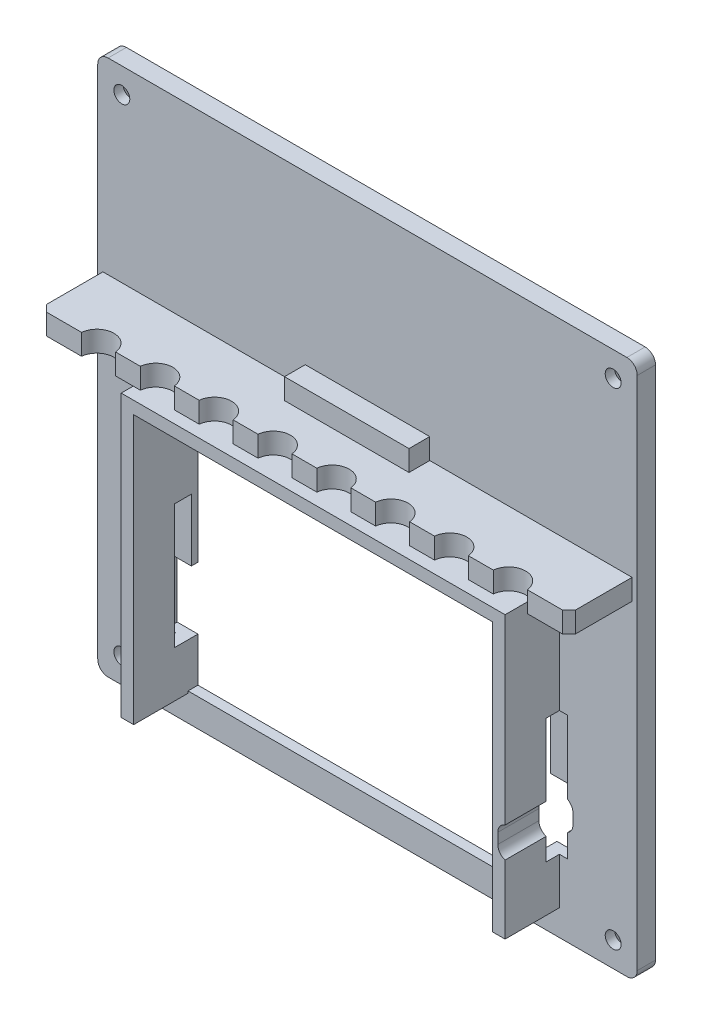
from build123d import *

# Parameters (mm, degrees)
SKETCH1_W                                      = 83.058
SKETCH1_H                                      = 82.55
BOSS_EXTRUDE1_DEPTH                            = 2.794
SKETCH2_W                                      = 58.7375
SKETCH2_H                                      = 42.9895
SKETCH2_W_2                                    = 54.9275
SKETCH2_H_2                                    = 39.1795
BOSS_EXTRUDE2_DEPTH                            = 11.1125
SKETCH5_W                                      = 66.929
SKETCH5_H                                      = 49.403
CUT_EXTRUDE1_DEPTH                             = 1.27
SKETCH2_2_W                                    = 54.9275
SKETCH2_2_H                                    = 39.1795
CUT_EXTRUDE2_DEPTH                             = 60.596737513
CSK_FOR_2_FLAT_HEAD_MACHINE_SCREW1_D           = 2.4384
CSK_FOR_2_FLAT_HEAD_MACHINE_SCREW1_CSINK_D     = 4.8104044
CSK_FOR_2_FLAT_HEAD_MACHINE_SCREW1_CSINK_ANGLE = 82
SKETCH9_W                                      = 12.7
SKETCH9_H                                      = 2.54
CUT_EXTRUDE4_DEPTH                             = 9.8044
SKETCH10_W                                     = 12.7
SKETCH10_H                                     = 3.048
CUT_EXTRUDE5_DEPTH                             = 0.254
SKETCH11_W                                     = 3.175
SKETCH11_H                                     = 9.525
CUT_EXTRUDE7_DEPTH                             = 1.524
SKETCH12_W                                     = 2.032
SKETCH12_H                                     = 19.05
CUT_EXTRUDE8_DEPTH                             = 82.161030266
SKETCH14_W                                     = 3.175
SKETCH14_H                                     = 19.05
CUT_EXTRUDE11_DEPTH                            = 0.508
FILLET2_R                                      = 4.7625
SKETCH15_W                                     = 54.9275
SKETCH15_H                                     = 1.905
CUT_EXTRUDE12_DEPTH                            = 8.3185
SKETCH16_W                                     = 54.9275
SKETCH16_H                                     = 1.524
CUT_EXTRUDE13_DEPTH                            = 1.5875
SKETCH17_W                                     = 12.7
SKETCH17_H                                     = 2.6543
BOSS_EXTRUDE3_DEPTH                            = 0.1016
SKETCH18_W                                     = 12.7
SKETCH18_H                                     = 0.3556
CUT_EXTRUDE14_DEPTH                            = 0.1016
SKETCH19_W                                     = 161.493776118
SKETCH19_H                                     = 133.946930056
SKETCH19_W_2                                   = 82.55
SKETCH19_H_2                                   = 82.042
CUT_EXTRUDE15_DEPTH                            = 60.596737513
FILLET3_R                                      = 1.5875
SKETCH21_W                                     = 80.9625
SKETCH21_H                                     = 3.175
BOSS_EXTRUDE4_DEPTH                            = 9.906
SKETCH22_W                                     = 19.05
SKETCH22_H                                     = 9.525
BOSS_EXTRUDE5_DEPTH                            = 3.175
SKETCH23_W                                     = 12.7
SKETCH23_H                                     = 1.016
CUT_EXTRUDE16_DEPTH                            = 7.8994
SKETCH24_R                                     = 2.60985
CUT_EXTRUDE17_DEPTH                            = 67.163598214
SKETCH25_W                                     = 80.9625
SKETCH25_H                                     = 3.175
CUT_EXTRUDE18_DEPTH                            = 0.254
CHAMFER1_SIZE                                  = 1.016
CUT_EXTRUDE19_DEPTH                            = 60.255810196
SKETCH29_W                                     = 54.9275
SKETCH29_H                                     = 4.1021
CUT_EXTRUDE20_DEPTH                            = 0.381
CHAMFER2_SIZE                                  = 0.508


with BuildPart() as part:
    # Sketch1 → Boss-Extrude1 (new body)
    with BuildSketch(Plane.XY):
        Rectangle(SKETCH1_W, SKETCH1_H)
    extrude(amount=BOSS_EXTRUDE1_DEPTH)

    # Sketch2 → Boss-Extrude2 (add)
    with BuildSketch(Plane(origin=(0, 0, 0), x_dir=(-1, 0, 0), z_dir=(0, 0, -1))):
        with Locations((0, -15.56385)):
            Rectangle(SKETCH2_W, SKETCH2_H)
        with Locations((0, -15.56385)):
            Rectangle(SKETCH2_W_2, SKETCH2_H_2, mode=Mode.SUBTRACT)
    extrude(amount=-BOSS_EXTRUDE2_DEPTH)

    # Sketch5 → Cut-Extrude1 (cut)
    with BuildSketch(Plane(origin=(0, 0, 0), x_dir=(-1, 0, 0), z_dir=(0, 0, -1))):
        with Locations((0, -16.5735)):
            Rectangle(SKETCH5_W, SKETCH5_H)
    extrude(amount=-CUT_EXTRUDE1_DEPTH, mode=Mode.SUBTRACT)

    # Sketch2<2> → Cut-Extrude2 (cut, through all)
    with BuildSketch(Plane(origin=(0, 0, 0), x_dir=(-1, 0, 0), z_dir=(0, 0, -1))):
        with Locations((0, -15.56385)):
            Rectangle(SKETCH2_2_W, SKETCH2_2_H)
    extrude(amount=-CUT_EXTRUDE2_DEPTH, mode=Mode.SUBTRACT)

    # CSK for #2 Flat Head Machine Screw1 (through all)
    with Locations(Plane(origin=(0, 0, 0), x_dir=(-1, 0, 0), z_dir=(0, 0, -1))):
        with Locations((37.592, 37.211), (-37.592, 37.211), (-37.592, -37.211), (37.592, -37.211)):
            CounterSinkHole(CSK_FOR_2_FLAT_HEAD_MACHINE_SCREW1_D / 2, CSK_FOR_2_FLAT_HEAD_MACHINE_SCREW1_CSINK_D / 2, counter_sink_angle=CSK_FOR_2_FLAT_HEAD_MACHINE_SCREW1_CSINK_ANGLE)

    # Sketch9 → Cut-Extrude4 (cut)
    with BuildSketch(Plane.XZ.offset(-4.0259)):
        with Locations((0, 2.54)):
            Rectangle(SKETCH9_W, SKETCH9_H)
    extrude(amount=-CUT_EXTRUDE4_DEPTH, mode=Mode.SUBTRACT)

    # Sketch10 → Cut-Extrude5 (cut)
    with BuildSketch(Plane.XY.offset(1.27)):
        with Locations((0, 12.3063)):
            Rectangle(SKETCH10_W, SKETCH10_H)
    extrude(amount=-CUT_EXTRUDE5_DEPTH, mode=Mode.SUBTRACT)

    # Sketch11 → Cut-Extrude7 (cut)
    with BuildSketch(Plane(origin=(0, 0, 1.27), x_dir=(-1, 0, 0), z_dir=(0, 0, -1))):
        with Locations((-29.05125, -25.2095)):
            Rectangle(SKETCH11_W, SKETCH11_H)
    cut_extrude7 = extrude(amount=-CUT_EXTRUDE7_DEPTH, mode=Mode.SUBTRACT)

    # Sketch12 → Cut-Extrude8 (cut, through all)
    with BuildSketch(Plane.ZY.offset(-27.46375)):
        with Locations((3.81, -20.447)):
            Rectangle(SKETCH12_W, SKETCH12_H)
    cut_extrude8 = extrude(amount=-CUT_EXTRUDE8_DEPTH, mode=Mode.SUBTRACT)

    # Sketch14 → Cut-Extrude11 (cut)
    with BuildSketch(Plane.XY.offset(2.794)):
        with Locations((29.05125, -20.447)):
            Rectangle(SKETCH14_W, SKETCH14_H)
    cut_extrude11 = extrude(amount=-CUT_EXTRUDE11_DEPTH, mode=Mode.SUBTRACT)

    # Mirror1: Cut-Extrude7, Cut-Extrude8, Cut-Extrude11 across plane
    add(cut_extrude7.mirror(Plane(origin=(0, 0, 0), x_dir=(0, 0, 1), z_dir=(1, 0, 0))), mode=Mode.SUBTRACT)
    add(cut_extrude8.mirror(Plane(origin=(0, 0, 0), x_dir=(0, 0, 1), z_dir=(1, 0, 0))), mode=Mode.SUBTRACT)
    add(cut_extrude11.mirror(Plane(origin=(0, 0, 0), x_dir=(0, 0, 1), z_dir=(1, 0, 0))), mode=Mode.SUBTRACT)

    # Fillet2
    fillet2_edges = [part.edges().sort_by_distance(p)[0] for p in [
        (-33.4645, 8.128, 0.635),
        (33.4645, 8.128, 0.635),
    ]]
    fillet(fillet2_edges, radius=FILLET2_R)

    # Sketch15 → Cut-Extrude12 (cut)
    with BuildSketch(Plane.XY.offset(11.1125)):
        with Locations((0, -36.1061)):
            Rectangle(SKETCH15_W, SKETCH15_H)
    extrude(amount=-CUT_EXTRUDE12_DEPTH, mode=Mode.SUBTRACT)

    # Sketch16 → Cut-Extrude13 (cut)
    with BuildSketch(Plane(origin=(0, -35.1536, 0), x_dir=(1, 0, 0), z_dir=(0, 1, 0))):
        with Locations((0, -2.032)):
            Rectangle(SKETCH16_W, SKETCH16_H)
    extrude(amount=-CUT_EXTRUDE13_DEPTH, mode=Mode.SUBTRACT)

    # Sketch17 → Boss-Extrude3 (add)
    with BuildSketch(Plane.XY.offset(1.27)):
        with Locations((0, 9.45515)):
            Rectangle(SKETCH17_W, SKETCH17_H)
    extrude(amount=BOSS_EXTRUDE3_DEPTH)

    # Sketch18 → Cut-Extrude14 (cut)
    with BuildSketch(Plane(origin=(0, 10.7823, 0), x_dir=(1, 0, 0), z_dir=(0, 1, 0))):
        with Locations((0, -1.1938)):
            Rectangle(SKETCH18_W, SKETCH18_H)
    extrude(amount=-CUT_EXTRUDE14_DEPTH, mode=Mode.SUBTRACT)

    # Sketch19 → Cut-Extrude15 (cut, through all)
    with BuildSketch(Plane(origin=(0, 0, 0), x_dir=(-1, 0, 0), z_dir=(0, 0, -1))):
        Rectangle(SKETCH19_W, SKETCH19_H)
        Rectangle(SKETCH19_W_2, SKETCH19_H_2, mode=Mode.SUBTRACT)
    extrude(amount=-CUT_EXTRUDE15_DEPTH, mode=Mode.SUBTRACT)

    # Fillet3
    fillet3_edges = [part.edges().sort_by_distance(p)[0] for p in [
        (41.275, 41.021, 1.397),
        (-41.275, 41.021, 1.397),
        (-41.275, -41.021, 1.397),
        (41.275, -41.021, 1.397),
    ]]
    fillet(fillet3_edges, radius=FILLET3_R)

    # Sketch21 → Boss-Extrude4 (add)
    with BuildSketch(Plane.XY.offset(2.794)):
        with Locations((0, 10.6934)):
            Rectangle(SKETCH21_W, SKETCH21_H)
    extrude(amount=BOSS_EXTRUDE4_DEPTH)

    # Sketch22 → Boss-Extrude5 (add)
    with BuildSketch(Plane.XY.offset(2.794)):
        with Locations((0, 10.6934)):
            Rectangle(SKETCH22_W, SKETCH22_H)
    extrude(amount=BOSS_EXTRUDE5_DEPTH)

    # Sketch23 → Cut-Extrude16 (cut)
    with BuildSketch(Plane.XZ.offset(-5.9309)):
        with Locations((0, 3.302)):
            Rectangle(SKETCH23_W, SKETCH23_H)
    extrude(amount=-CUT_EXTRUDE16_DEPTH, mode=Mode.SUBTRACT)

    # Sketch24 → Cut-Extrude17 (cut, through all)
    with BuildSketch(Plane.XZ.offset(-9.1059)):
        with Locations((-31.5, 12.7)):
            Circle(SKETCH24_R)
        with Locations((-22.5, 12.7)):
            Circle(SKETCH24_R)
        with Locations((31.5, 12.7)):
            Circle(SKETCH24_R)
        with Locations((22.5, 12.7)):
            Circle(SKETCH24_R)
        with Locations((13.5, 12.7)):
            Circle(SKETCH24_R)
        with Locations((4.5, 12.7)):
            Circle(SKETCH24_R)
        with Locations((-4.5, 12.7)):
            Circle(SKETCH24_R)
        with Locations((-13.5, 12.7)):
            Circle(SKETCH24_R)
    extrude(amount=-CUT_EXTRUDE17_DEPTH, mode=Mode.SUBTRACT)

    # Sketch25 → Cut-Extrude18 (cut)
    with BuildSketch(Plane.XY.offset(12.7)):
        with Locations((0, 10.6934)):
            Rectangle(SKETCH25_W, SKETCH25_H)
    extrude(amount=-CUT_EXTRUDE18_DEPTH, mode=Mode.SUBTRACT)

    # Chamfer1
    chamfer1_edges = [part.edges().sort_by_distance(p)[0] for p in [
        (-40.48125, 10.6934, 12.446),
        (40.48125, 10.6934, 12.446),
    ]]
    chamfer(chamfer1_edges, length=CHAMFER1_SIZE)

    # Sketch26 → Cut-Extrude19 (cut, through all)
    with BuildSketch(Plane(origin=(0, 0, 1.27), x_dir=(-1, 0, 0), z_dir=(0, 0, -1))):
        with BuildLine():
            Line((-28.2575, -23.45055), (-28.2575, -25.06345))
            ThreePointArc((-28.2575, -25.06345), (-29.845, -26.65095), (-31.4325, -25.06345))
            Line((-31.4325, -25.06345), (-31.4325, -23.45055))
            ThreePointArc((-31.4325, -23.45055), (-29.845, -21.86305), (-28.2575, -23.45055))
        make_face()
    extrude(amount=-CUT_EXTRUDE19_DEPTH, mode=Mode.SUBTRACT)

    # Sketch29 → Cut-Extrude20 (cut)
    with BuildSketch(Plane(origin=(0, 0, 1.27), x_dir=(-1, 0, 0), z_dir=(0, 0, -1))):
        with Locations((0, 6.07695)):
            Rectangle(SKETCH29_W, SKETCH29_H)
    extrude(amount=-CUT_EXTRUDE20_DEPTH, mode=Mode.SUBTRACT)

    # Chamfer2
    chamfer2_edges = [part.edges().sort_by_distance(p)[0] for p in [
        (-16.906875, 4.0259, 1.651),
        (16.906875, 4.0259, 1.651),
    ]]
    chamfer(chamfer2_edges, length=CHAMFER2_SIZE)


solid = part.part
